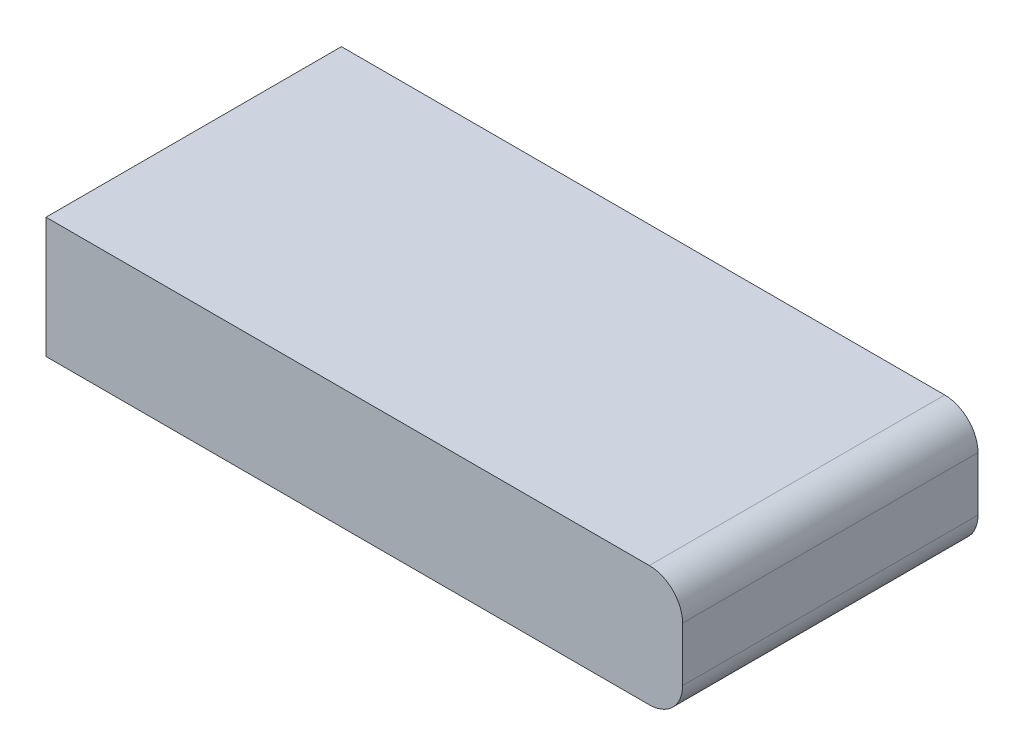
from build123d import *

# Parameters (mm, degrees)
SKETCH_1_W      = 153
SKETCH_1_H      = 71
EXTRUDE_1_DEPTH = 29
FILLET_1_R      = 8
FILLET_2_R      = 8


with BuildPart() as part:
    # 草图1 → 凸台-拉伸1 (new body)
    with BuildSketch(Plane(origin=(0, 0, 0), x_dir=(1, 0, 0), z_dir=(0, 1, 0))):
        Rectangle(SKETCH_1_W, SKETCH_1_H)
    extrude(amount=EXTRUDE_1_DEPTH)

    # 圆角1
    fillet_1_edges = [part.edges().sort_by_distance(p)[0] for p in [
        (76.5, 29, 0),
    ]]
    fillet(fillet_1_edges, radius=FILLET_1_R)

    # 圆角2
    fillet_2_edges = [part.edges().sort_by_distance(p)[0] for p in [
        (76.5, 0, 0),
    ]]
    fillet(fillet_2_edges, radius=FILLET_2_R)


solid = part.part
